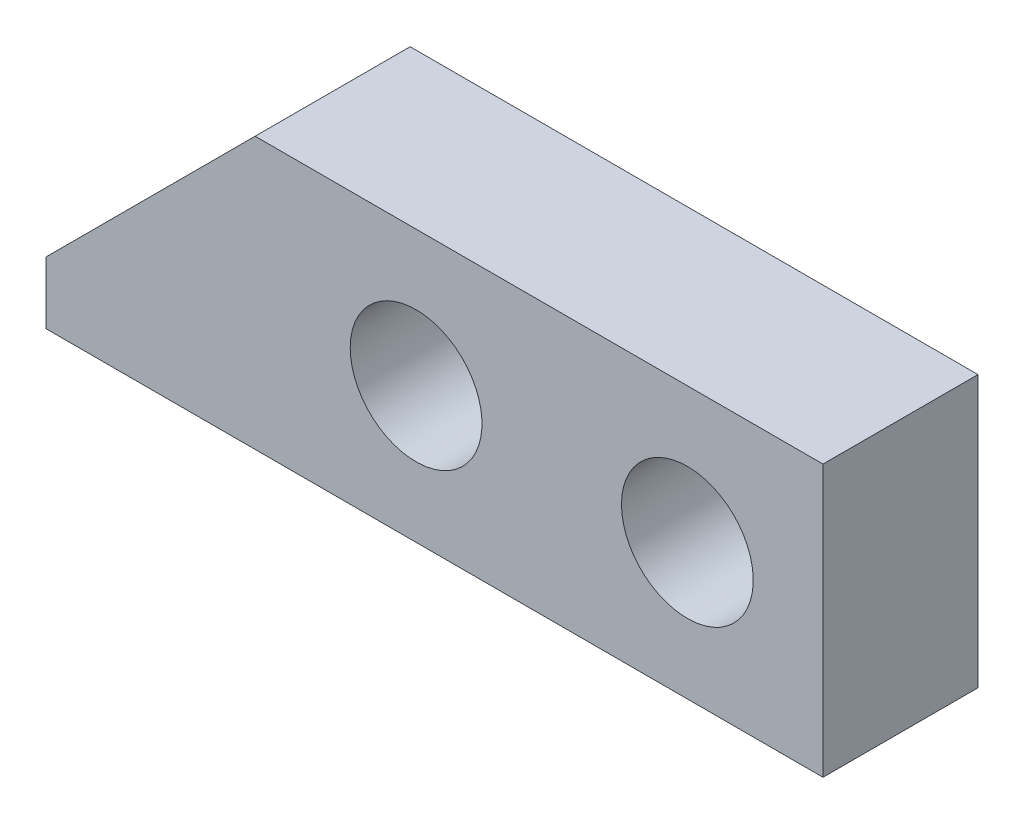
from build123d import *

# Parameters (mm, degrees)
BOSS_EXTRUDE1_DEPTH                                 = 4
CSK_FOR_M3_COUNTERSUNK_FLAT_HEAD_SCREW1_D           = 3.4
CSK_FOR_M3_COUNTERSUNK_FLAT_HEAD_SCREW1_CSINK_D     = 6.3
CSK_FOR_M3_COUNTERSUNK_FLAT_HEAD_SCREW1_CSINK_ANGLE = 90
TAP_DRILL_FOR_M2_TAP1_D                             = 1.9


with BuildPart() as part:
    # Sketch1 → Boss-Extrude1 (new body)
    with BuildSketch(Plane.XY):
        Polygon((5.396358967, 7), (20.05, 7), (20.05, 0), (0, 0), (0, 1.603641033), align=None)
    extrude(amount=BOSS_EXTRUDE1_DEPTH)

    # CSK for M3 Countersunk Flat Head Screw1 (through all)
    with Locations(Plane(origin=(0, 0, 0), x_dir=(1, 0, 0), z_dir=(0, 0, -1))):
        with Locations((16.55, -3.5), (9.55, -3.5)):
            CounterSinkHole(CSK_FOR_M3_COUNTERSUNK_FLAT_HEAD_SCREW1_D / 2, CSK_FOR_M3_COUNTERSUNK_FLAT_HEAD_SCREW1_CSINK_D / 2, counter_sink_angle=CSK_FOR_M3_COUNTERSUNK_FLAT_HEAD_SCREW1_CSINK_ANGLE)

    # Tap Drill for M2 Tap1 (through all)
    with Locations(Plane(origin=(-0.801820516, 0.801820516, 0), x_dir=(0, 0, 1), z_dir=(-0.7071067811865492, 0.7071067811865459, 0))):
        with Locations((2, 4.949747468)):
            Hole(TAP_DRILL_FOR_M2_TAP1_D / 2)


solid = part.part
